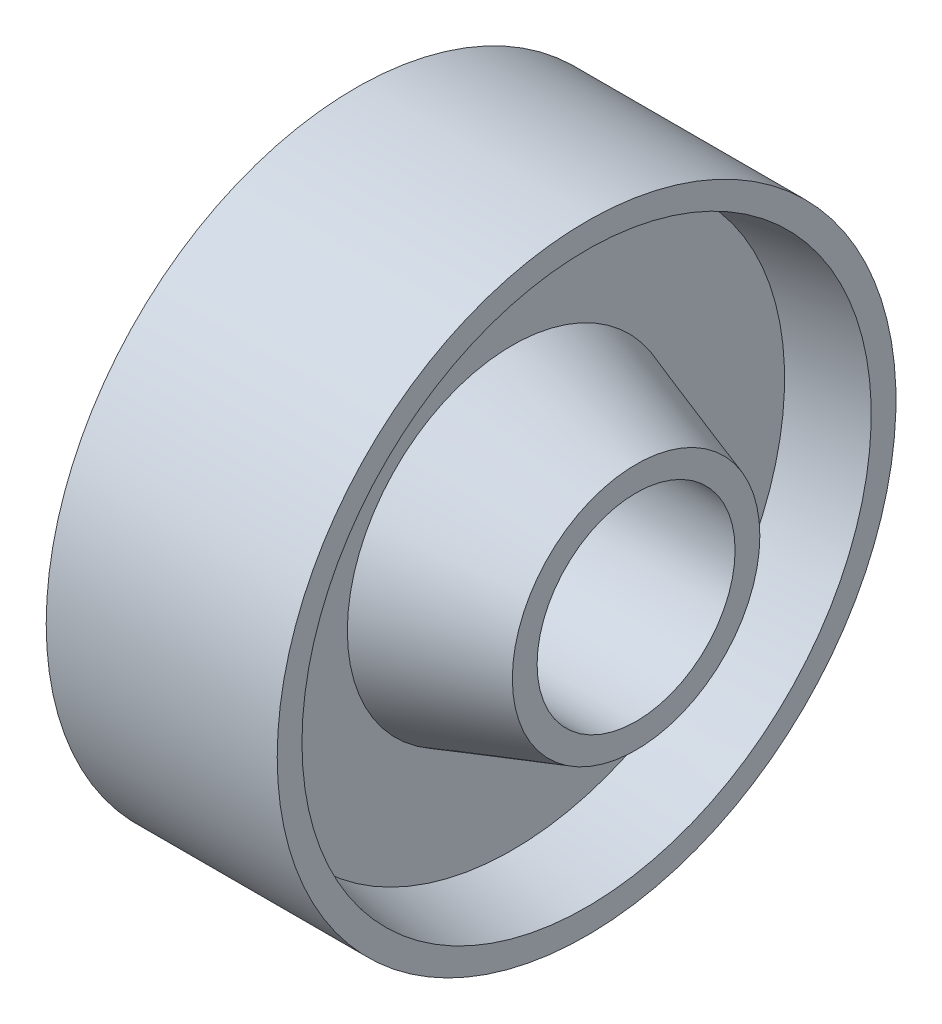
from build123d import *

# Parameters (mm, degrees)
SKETCH1_W   = 40
SKETCH1_H   = 3
SKETCH1_W_2 = 10
SKETCH1_H_2 = 13
SKETCH1_W_3 = 28


with BuildPart() as part:
    # Sketch1 → Revolve1 (revolve)
    with BuildSketch(Plane.XY, mode=Mode.PRIVATE) as revolve1_sk:
        with Locations((0, -13.5)):
            Rectangle(SKETCH1_W, SKETCH1_H)
        Polygon((20, -15), (5, -20), (-5, -20), (-20, -15), align=None)
        with Locations((0, -26.5)):
            Rectangle(SKETCH1_W_2, SKETCH1_H_2)
        Polygon((5, -33), (14, -34.5), (-14, -34.5), (-5, -33), align=None)
        with Locations((0, -36)):
            Rectangle(SKETCH1_W_3, SKETCH1_H)
    revolve(revolve1_sk.sketch.rotate(Axis((0, 0, 0), (1, 0, 0)), 270), axis=Axis((0, 0, 0), (1, 0, 0)))


solid = part.part
